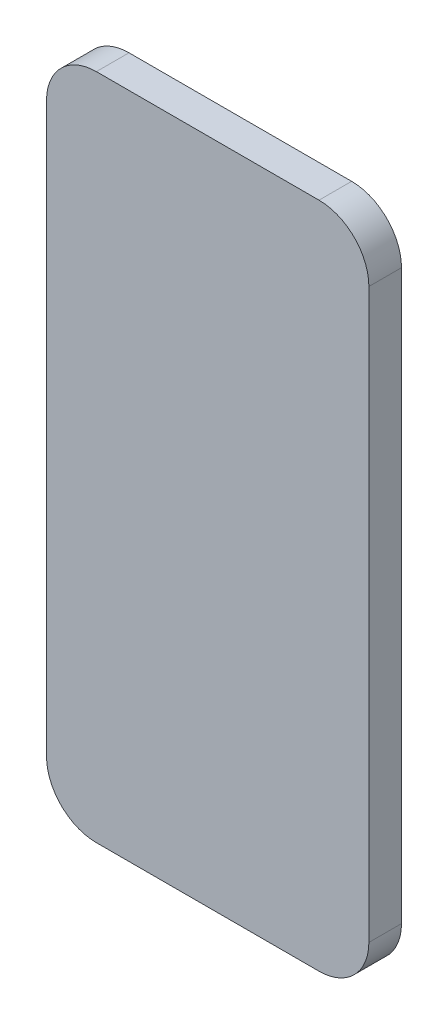
from build123d import *

# Parameters (mm, degrees)
BOSS_EXTRUDE1_DEPTH = 7.85


with BuildPart() as part:
    # Sketch1 → Boss-Extrude1 (new body)
    with BuildSketch(Plane.XY):
        with BuildLine():
            Line((-40.766029412, 76.017401961), (12.813970588, 76.017401961))
            ThreePointArc((12.813970588, 76.017401961), (21.299251962, 72.502683335), (24.813970588, 64.017401961))
            Line((24.813970588, 64.017401961), (24.813970588, -72.682598039))
            ThreePointArc((24.813970588, -72.682598039), (21.299251962, -81.167879413), (12.813970588, -84.682598039))
            Line((12.813970588, -84.682598039), (-40.766029412, -84.682598039))
            ThreePointArc((-40.766029412, -84.682598039), (-49.251310786, -81.167879413), (-52.766029412, -72.682598039))
            Line((-52.766029412, -72.682598039), (-52.766029412, 64.017401961))
            ThreePointArc((-52.766029412, 64.017401961), (-49.251310786, 72.502683335), (-40.766029412, 76.017401961))
        make_face()
    extrude(amount=BOSS_EXTRUDE1_DEPTH)


solid = part.part
